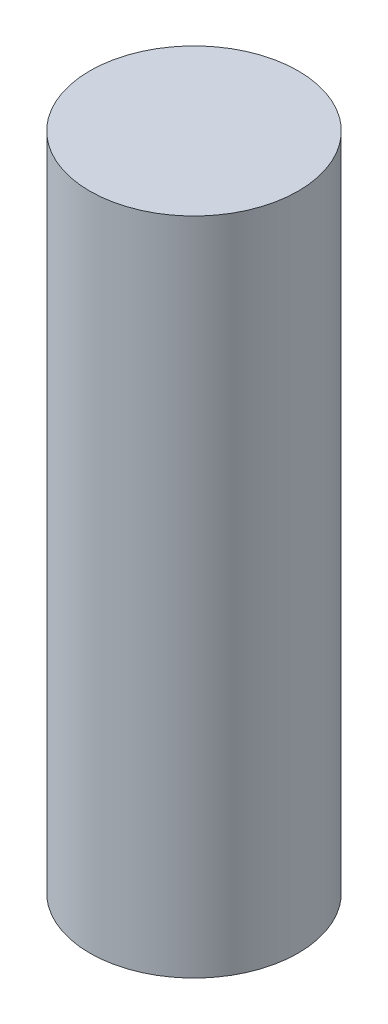
from build123d import *

# Parameters (mm, degrees)
SKETCH1_R           = 3
BOSS_EXTRUDE1_DEPTH = 19


with BuildPart() as part:
    # Sketch1 → Boss-Extrude1 (new body)
    with BuildSketch(Plane(origin=(0, 0, 0), x_dir=(1, 0, 0), z_dir=(0, 1, 0))):
        with Locations(Location((0, 0, 0), (0, 0, 270))):
            Circle(SKETCH1_R)
    extrude(amount=BOSS_EXTRUDE1_DEPTH)


solid = part.part
